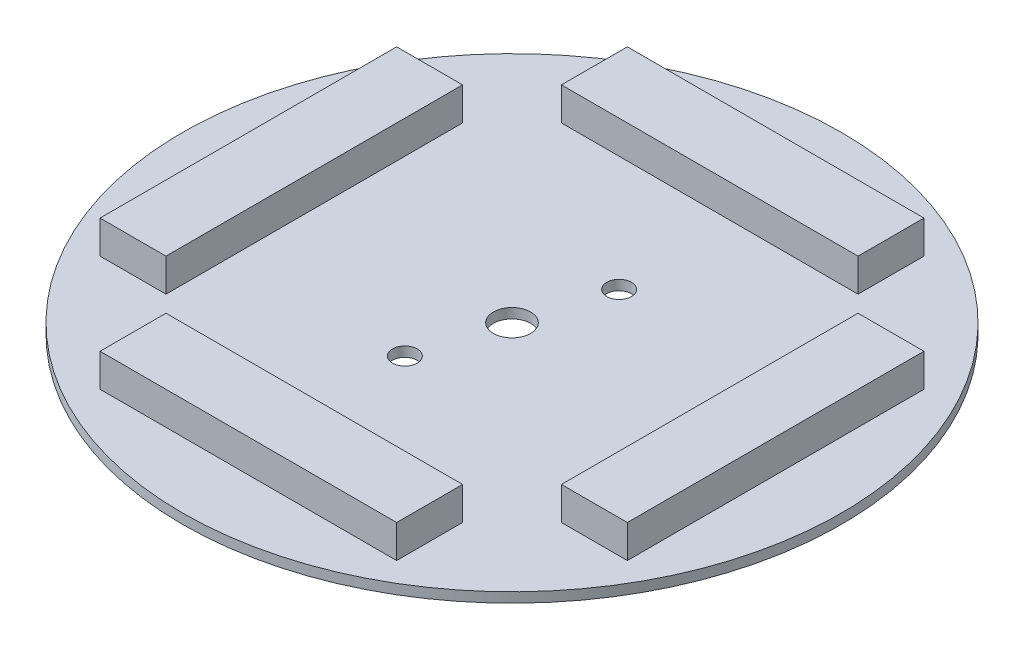
from build123d import *

# Parameters (mm, degrees)
SKETCH1_R                    = 20
SKETCH1_R_2                  = 1.1303
SKETCH1_R_3                  = 0.75
PCB_DEPTH                    = 0.6
SKETCH2_W                    = 18
SKETCH2_H                    = 4
HIROSE_CONNECTOR_STACK_DEPTH = 2
CIRPATTERN1_COUNT            = 4


with BuildPart() as part:
    # Sketch1 → PCB (new body)
    with BuildSketch(Plane(origin=(0, 0, 0), x_dir=(1, 0, 0), z_dir=(0, 1, 0))):
        with Locations(Location((0, 0, 0), (0, 0, 270))):
            Circle(SKETCH1_R)
        with Locations(Location((0, 0, 0), (0, 0, 270))):
            Circle(SKETCH1_R_2, mode=Mode.SUBTRACT)
        with Locations(Location((1.5, 5, 0), (0, 0, 270))):
            Circle(SKETCH1_R_3, mode=Mode.SUBTRACT)
        with Locations(Location((-1.5, -5, 0), (0, 0, 270))):
            Circle(SKETCH1_R_3, mode=Mode.SUBTRACT)
    extrude(amount=PCB_DEPTH)

    # Sketch2 → Hirose Connector Stack (add)
    with BuildSketch(Plane(origin=(0, 0.6, 0), x_dir=(1, 0, 0), z_dir=(0, 1, 0))):
        with Locations((0, 14)):
            Rectangle(SKETCH2_W, SKETCH2_H)
    hirose_connector_stack = extrude(amount=HIROSE_CONNECTOR_STACK_DEPTH)

    # CirPattern1: Hirose Connector Stack ×4 about axis
    cirpattern1_axis = Axis((0, 0, 0), (0, 1, 0))
    for i in range(1, CIRPATTERN1_COUNT):
        add(hirose_connector_stack.rotate(cirpattern1_axis, i * 360 / CIRPATTERN1_COUNT))


solid = part.part
